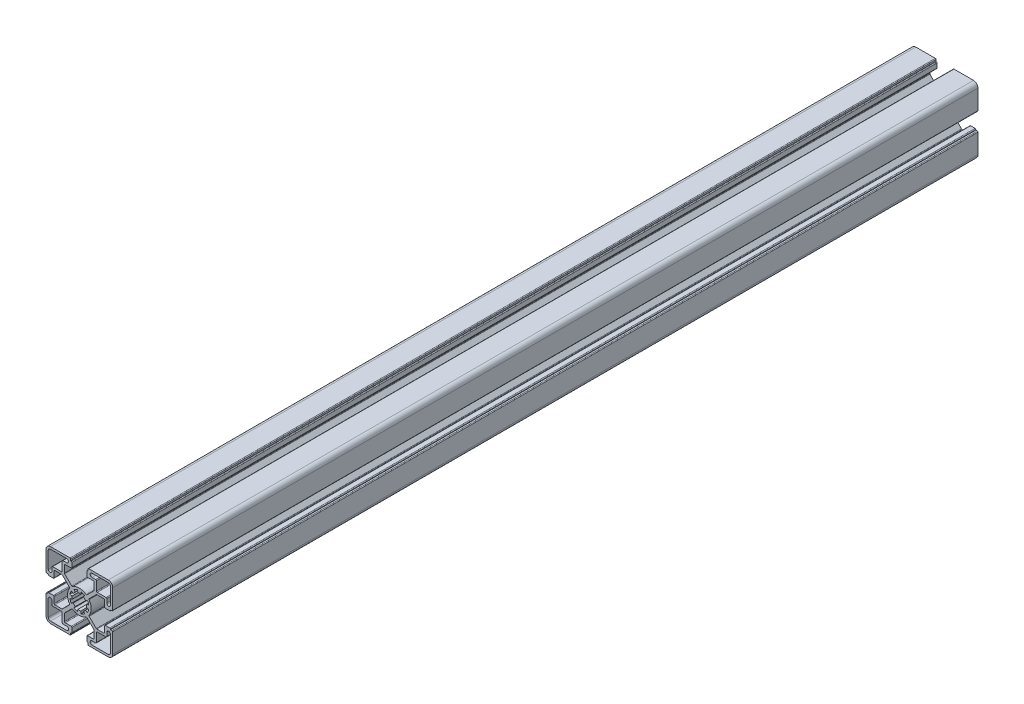
from build123d import *

# Parameters (mm, degrees)
BOSS_EXTRUDE1_DEPTH      = 152.4
BOSS_EXTRUDE1_DEPTH_BACK = 152.4
SKETCH3_R                = 5
FILLET1_R                = 0.5
CUT_EXTRUDE1_DEPTH       = 307.456424309
BOSS_EXTRUDE2_DEPTH      = 279.1


with BuildPart() as part:
    # Sketch3 → Boss-Extrude1 (new, two sides: drawn at the far end of the back side and taken through both)
    with BuildSketch(Plane.XY.offset(-BOSS_EXTRUDE1_DEPTH_BACK)):
        with BuildLine():
            Line((-11.55, -10.05), (-6.356915373, -4.856915373))
            ThreePointArc((-6.356915373, -4.856915373), (-8, 0), (-6.356915373, 4.856915373))
            Line((-6.356915373, 4.856915373), (-11.55, 10.05))
            Line((-11.55, 10.05), (-17.025, 10.05))
            Line((-17.025, 10.05), (-17.025, 5))
            Line((-17.025, 5), (-21, 5))
            Line((-21, 5), (-21, 5.8))
            Line((-21, 5.8), (-22.5, 5.8))
            Line((-22.5, 5.8), (-22.5, 19.5))
            ThreePointArc((-22.5, 19.5), (-21.621320344, 21.621320344), (-19.5, 22.5))
            Line((-19.5, 22.5), (-5.8, 22.5))
            Line((-5.8, 22.5), (-5.8, 21))
            Line((-5.8, 21), (-5, 21))
            Line((-5, 21), (-5, 17.025))
            Line((-5, 17.025), (-10.05, 17.025))
            Line((-10.05, 17.025), (-10.05, 11.55))
            Line((-10.05, 11.55), (-4.856915373, 6.356915373))
            ThreePointArc((-4.856915373, 6.356915373), (0, 8), (4.856915373, 6.356915373))
            Line((4.856915373, 6.356915373), (10.05, 11.55))
            Line((10.05, 11.55), (10.05, 17.025))
            Line((10.05, 17.025), (5, 17.025))
            Line((5, 17.025), (5, 21))
            Line((5, 21), (5.8, 21))
            Line((5.8, 21), (5.8, 22.5))
            Line((5.8, 22.5), (19.5, 22.5))
            ThreePointArc((19.5, 22.5), (21.621320344, 21.621320344), (22.5, 19.5))
            Line((22.5, 19.5), (22.5, 5.8))
            Line((22.5, 5.8), (21, 5.8))
            Line((21, 5.8), (21, 5))
            Line((21, 5), (17.025, 5))
            Line((17.025, 5), (17.025, 10.05))
            Line((17.025, 10.05), (11.55, 10.05))
            Line((11.55, 10.05), (6.356915373, 4.856915373))
            ThreePointArc((6.356915373, 4.856915373), (8, 0), (6.356915373, -4.856915373))
            Line((6.356915373, -4.856915373), (11.55, -10.05))
            Line((11.55, -10.05), (17.025, -10.05))
            Line((17.025, -10.05), (17.025, -5))
            Line((17.025, -5), (21, -5))
            Line((21, -5), (21, -5.8))
            Line((21, -5.8), (22.5, -5.8))
            Line((22.5, -5.8), (22.5, -19.5))
            ThreePointArc((22.5, -19.5), (21.621320344, -21.621320344), (19.5, -22.5))
            Line((19.5, -22.5), (5.8, -22.5))
            Line((5.8, -22.5), (5.8, -21))
            Line((5.8, -21), (5, -21))
            Line((5, -21), (5, -17.025))
            Line((5, -17.025), (10.05, -17.025))
            Line((10.05, -17.025), (10.05, -11.55))
            Line((10.05, -11.55), (4.856915373, -6.356915373))
            ThreePointArc((4.856915373, -6.356915373), (0, -8), (-4.856915373, -6.356915373))
            Line((-4.856915373, -6.356915373), (-10.05, -11.55))
            Line((-10.05, -11.55), (-10.05, -17.025))
            Line((-10.05, -17.025), (-5, -17.025))
            Line((-5, -17.025), (-5, -21))
            Line((-5, -21), (-5.8, -21))
            Line((-5.8, -21), (-5.8, -22.5))
            Line((-5.8, -22.5), (-19.5, -22.5))
            ThreePointArc((-19.5, -22.5), (-21.621320344, -21.621320344), (-22.5, -19.5))
            Line((-22.5, -19.5), (-22.5, -5.8))
            Line((-22.5, -5.8), (-21, -5.8))
            Line((-21, -5.8), (-21, -5))
            Line((-21, -5), (-17.025, -5))
            Line((-17.025, -5), (-17.025, -10.05))
            Line((-17.025, -10.05), (-11.55, -10.05))
        make_face()
        with Locations(Location((0, 0, 0), (0, 0, 180))):
            Circle(SKETCH3_R, mode=Mode.SUBTRACT)
        with BuildLine():
            Line((-21, 8.5375), (-21, 19.5))
            ThreePointArc((-21, 19.5), (-20.560660172, 20.560660172), (-19.5, 21))
            Line((-19.5, 21), (-8.5375, 21))
            ThreePointArc((-8.5375, 21), (-7.3, 19.7625), (-8.5375, 18.525))
            Line((-8.5375, 18.525), (-11.55, 18.525))
            Line((-11.55, 18.525), (-11.55, 11.55))
            Line((-11.55, 11.55), (-18.525, 11.55))
            Line((-18.525, 11.55), (-18.525, 8.5375))
            ThreePointArc((-18.525, 8.5375), (-19.7625, 7.3), (-21, 8.5375))
        make_face(mode=Mode.SUBTRACT)
        with BuildLine():
            Line((8.5375, 21), (19.5, 21))
            ThreePointArc((19.5, 21), (20.560660172, 20.560660172), (21, 19.5))
            Line((21, 19.5), (21, 8.5375))
            ThreePointArc((21, 8.5375), (19.7625, 7.3), (18.525, 8.5375))
            Line((18.525, 8.5375), (18.525, 11.55))
            Line((18.525, 11.55), (11.55, 11.55))
            Line((11.55, 11.55), (11.55, 18.525))
            Line((11.55, 18.525), (8.5375, 18.525))
            ThreePointArc((8.5375, 18.525), (7.3, 19.7625), (8.5375, 21))
        make_face(mode=Mode.SUBTRACT)
        with BuildLine():
            Line((21, -8.5375), (21, -19.5))
            ThreePointArc((21, -19.5), (20.560660172, -20.560660172), (19.5, -21))
            Line((19.5, -21), (8.5375, -21))
            ThreePointArc((8.5375, -21), (7.3, -19.7625), (8.5375, -18.525))
            Line((8.5375, -18.525), (11.55, -18.525))
            Line((11.55, -18.525), (11.55, -11.55))
            Line((11.55, -11.55), (18.525, -11.55))
            Line((18.525, -11.55), (18.525, -8.5375))
            ThreePointArc((18.525, -8.5375), (19.7625, -7.3), (21, -8.5375))
        make_face(mode=Mode.SUBTRACT)
        with BuildLine():
            Line((-8.5375, -21), (-19.5, -21))
            ThreePointArc((-19.5, -21), (-20.560660172, -20.560660172), (-21, -19.5))
            Line((-21, -19.5), (-21, -8.5375))
            ThreePointArc((-21, -8.5375), (-19.7625, -7.3), (-18.525, -8.5375))
            Line((-18.525, -8.5375), (-18.525, -11.55))
            Line((-18.525, -11.55), (-11.55, -11.55))
            Line((-11.55, -11.55), (-11.55, -18.525))
            Line((-11.55, -18.525), (-8.5375, -18.525))
            ThreePointArc((-8.5375, -18.525), (-7.3, -19.7625), (-8.5375, -21))
        make_face(mode=Mode.SUBTRACT)
    extrude(amount=BOSS_EXTRUDE1_DEPTH + BOSS_EXTRUDE1_DEPTH_BACK)

    # Fillet1
    fillet1_edges = [part.edges().sort_by_distance(p)[0] for p in [
        (-11.55, -18.525, 0),
        (-11.55, -11.55, 0),
        (18.525, -11.55, 0),
        (11.55, -11.55, 0),
        (11.55, -18.525, 0),
        (11.55, 18.525, 0),
        (11.55, 11.55, 0),
        (18.525, 11.55, 0),
        (-18.525, 11.55, 0),
        (-11.55, 11.55, 0),
        (-11.55, 18.525, 0),
        (6.356915373, -4.856915373, 0),
        (11.55, -10.05, 0),
        (17.025, -10.05, 0),
        (17.025, -5, 0),
        (21, -5, 0),
        (22.5, -5.8, 0),
        (5.8, -22.5, 0),
        (5, -21, 0),
        (5, -17.025, 0),
        (10.05, -17.025, 0),
        (10.05, -11.55, 0),
        (4.856915373, -6.356915373, 0),
        (-4.856915373, -6.356915373, 0),
        (-10.05, -11.55, 0),
        (-10.05, -17.025, 0),
        (-5, -17.025, 0),
        (-5, -21, 0),
        (-5.8, -22.5, 0),
        (-22.5, -5.8, 0),
        (-21, -5, 0),
        (-17.025, -5, 0),
        (-17.025, -10.05, 0),
        (-11.55, -10.05, 0),
        (-6.356915373, -4.856915373, 0),
        (-6.356915373, 4.856915373, 0),
        (-11.55, 10.05, 0),
        (-17.025, 10.05, 0),
        (-17.025, 5, 0),
        (-21, 5, 0),
        (-22.5, 5.8, 0),
        (-5.8, 22.5, 0),
        (-5, 21, 0),
        (-5, 17.025, 0),
        (-10.05, 17.025, 0),
        (-10.05, 11.55, 0),
        (-4.856915373, 6.356915373, 0),
        (4.856915373, 6.356915373, 0),
        (10.05, 11.55, 0),
        (10.05, 17.025, 0),
        (5, 17.025, 0),
        (5, 21, 0),
        (5.8, 22.5, 0),
        (22.5, 5.8, 0),
        (21, 5, 0),
        (17.025, 5, 0),
        (11.55, 10.05, 0),
        (6.356915373, 4.856915373, 0),
    ]]
    fillet(fillet1_edges, radius=FILLET1_R)

    # Sketch4 → Cut-Extrude1 (cut, through all)
    with BuildSketch(Plane.XY.offset(152.4)):
        with BuildLine():
            Line((-1.268087093, 6.375104323), (-0.97545161, 4.903926402))
            ThreePointArc((-0.97545161, 4.903926402), (-1.913417162, 4.619397663), (-2.777851165, 4.157348062))
            Line((-2.777851165, 4.157348062), (-3.611206515, 5.40455248))
            ThreePointArc((-3.611206515, 5.40455248), (-2.48744231, 6.005216961), (-1.268087093, 6.375104323))
        make_face()
        with BuildLine():
            Line((1.268087093, 6.375104323), (0.97545161, 4.903926402))
            ThreePointArc((0.97545161, 4.903926402), (1.913417162, 4.619397663), (2.777851165, 4.157348062))
            Line((2.777851165, 4.157348062), (3.611206515, 5.40455248))
            ThreePointArc((3.611206515, 5.40455248), (2.48744231, 6.005216961), (1.268087093, 6.375104323))
        make_face()
        with BuildLine():
            Line((5.40455248, 3.611206515), (4.157348062, 2.777851165))
            ThreePointArc((4.157348062, 2.777851165), (4.619397663, 1.913417162), (4.903926402, 0.97545161))
            Line((4.903926402, 0.97545161), (6.375104323, 1.268087093))
            ThreePointArc((6.375104323, 1.268087093), (6.005216961, 2.48744231), (5.40455248, 3.611206515))
        make_face()
        with BuildLine():
            Line((6.375104323, -1.268087093), (4.903926402, -0.97545161))
            ThreePointArc((4.903926402, -0.97545161), (4.619397663, -1.913417162), (4.157348062, -2.777851165))
            Line((4.157348062, -2.777851165), (5.40455248, -3.611206515))
            ThreePointArc((5.40455248, -3.611206515), (6.005216961, -2.48744231), (6.375104323, -1.268087093))
        make_face()
        with BuildLine():
            Line((3.611206515, -5.40455248), (2.777851165, -4.157348062))
            ThreePointArc((2.777851165, -4.157348062), (1.913417162, -4.619397663), (0.97545161, -4.903926402))
            Line((0.97545161, -4.903926402), (1.268087093, -6.375104323))
            ThreePointArc((1.268087093, -6.375104323), (2.48744231, -6.005216961), (3.611206515, -5.40455248))
        make_face()
        with BuildLine():
            Line((-1.268087093, -6.375104323), (-0.97545161, -4.903926402))
            ThreePointArc((-0.97545161, -4.903926402), (-1.913417162, -4.619397663), (-2.777851165, -4.157348062))
            Line((-2.777851165, -4.157348062), (-3.611206515, -5.40455248))
            ThreePointArc((-3.611206515, -5.40455248), (-2.48744231, -6.005216961), (-1.268087093, -6.375104323))
        make_face()
        with BuildLine():
            Line((-5.40455248, -3.611206515), (-4.157348062, -2.777851165))
            ThreePointArc((-4.157348062, -2.777851165), (-4.619397663, -1.913417162), (-4.903926402, -0.97545161))
            Line((-4.903926402, -0.97545161), (-6.375104323, -1.268087093))
            ThreePointArc((-6.375104323, -1.268087093), (-6.005216961, -2.48744231), (-5.40455248, -3.611206515))
        make_face()
        with BuildLine():
            Line((-6.375104323, 1.268087093), (-4.903926402, 0.97545161))
            ThreePointArc((-4.903926402, 0.97545161), (-4.619397663, 1.913417162), (-4.157348062, 2.777851165))
            Line((-4.157348062, 2.777851165), (-5.40455248, 3.611206515))
            ThreePointArc((-5.40455248, 3.611206515), (-6.005216961, 2.48744231), (-6.375104323, 1.268087093))
        make_face()
    extrude(amount=-CUT_EXTRUDE1_DEPTH, mode=Mode.SUBTRACT)

    # Sketch5 → Boss-Extrude2 (add)
    with BuildSketch(Plane.XY.offset(152.4)):
        with BuildLine():
            Line((22.5, -19.5), (22.5, -6.3))
            ThreePointArc((22.5, -6.3), (22.353553391, -5.946446609), (22, -5.8))
            Line((22, -5.8), (21, -5.8))
            Line((21, -5.8), (21, -5.5))
            ThreePointArc((21, -5.5), (20.853553391, -5.146446609), (20.5, -5))
            Line((20.5, -5), (17.525, -5))
            ThreePointArc((17.525, -5), (17.171446609, -5.146446609), (17.025, -5.5))
            Line((17.025, -5.5), (17.025, -9.55))
            ThreePointArc((17.025, -9.55), (16.878553391, -9.903553391), (16.525, -10.05))
            Line((16.525, -10.05), (11.757106781, -10.05))
            ThreePointArc((11.757106781, -10.05), (11.565765065, -10.011939766), (11.403553391, -9.903553391))
            Line((11.403553391, -9.903553391), (6.658229, -5.158229))
            ThreePointArc((6.658229, -5.158229), (6.513911961, -4.850773717), (6.599324603, -4.522047632))
            ThreePointArc((6.599324603, -4.522047632), (8, 0), (6.599324603, 4.522047632))
            ThreePointArc((6.599324603, 4.522047632), (6.513911961, 4.850773717), (6.658229, 5.158229))
            Line((6.658229, 5.158229), (11.403553391, 9.903553391))
            ThreePointArc((11.403553391, 9.903553391), (11.565765065, 10.011939766), (11.757106781, 10.05))
            Line((11.757106781, 10.05), (17.025, 10.05))
            Line((17.025, 10.05), (17.025, 5.5))
            ThreePointArc((17.025, 5.5), (17.171446609, 5.146446609), (17.525, 5))
            Line((17.525, 5), (20.5, 5))
            ThreePointArc((20.5, 5), (20.853553391, 5.146446609), (21, 5.5))
            Line((21, 5.5), (21, 5.8))
            Line((21, 5.8), (22, 5.8))
            ThreePointArc((22, 5.8), (22.353553391, 5.946446609), (22.5, 6.3))
            Line((22.5, 6.3), (22.5, 19.5))
            ThreePointArc((22.5, 19.5), (21.621320344, 21.621320344), (19.5, 22.5))
            Line((19.5, 22.5), (6.3, 22.5))
            ThreePointArc((6.3, 22.5), (5.946446609, 22.353553391), (5.8, 22))
            Line((5.8, 22), (5.8, 21))
            Line((5.8, 21), (5.5, 21))
            ThreePointArc((5.5, 21), (5.146446609, 20.853553391), (5, 20.5))
            Line((5, 20.5), (5, 17.525))
            ThreePointArc((5, 17.525), (5.146446609, 17.171446609), (5.5, 17.025))
            Line((5.5, 17.025), (9.55, 17.025))
            ThreePointArc((9.55, 17.025), (9.903553391, 16.878553391), (10.05, 16.525))
            Line((10.05, 16.525), (10.05, 11.757106781))
            ThreePointArc((10.05, 11.757106781), (10.011939766, 11.565765065), (9.903553391, 11.403553391))
            Line((9.903553391, 11.403553391), (5.158229, 6.658229))
            ThreePointArc((5.158229, 6.658229), (4.850773717, 6.513911961), (4.522047632, 6.599324603))
            ThreePointArc((4.522047632, 6.599324603), (0, 8), (-4.522047632, 6.599324603))
            ThreePointArc((-4.522047632, 6.599324603), (-4.850773717, 6.513911961), (-5.158229, 6.658229))
            Line((-5.158229, 6.658229), (-9.903553391, 11.403553391))
            ThreePointArc((-9.903553391, 11.403553391), (-10.011939766, 11.565765065), (-10.05, 11.757106781))
            Line((-10.05, 11.757106781), (-10.05, 16.525))
            ThreePointArc((-10.05, 16.525), (-9.903553391, 16.878553391), (-9.55, 17.025))
            Line((-9.55, 17.025), (-5.5, 17.025))
            ThreePointArc((-5.5, 17.025), (-5.146446609, 17.171446609), (-5, 17.525))
            Line((-5, 17.525), (-5, 20.5))
            ThreePointArc((-5, 20.5), (-5.146446609, 20.853553391), (-5.5, 21))
            Line((-5.5, 21), (-5.8, 21))
            Line((-5.8, 21), (-5.8, 22))
            ThreePointArc((-5.8, 22), (-5.946446609, 22.353553391), (-6.3, 22.5))
            Line((-6.3, 22.5), (-19.5, 22.5))
            ThreePointArc((-19.5, 22.5), (-21.621320344, 21.621320344), (-22.5, 19.5))
            Line((-22.5, 19.5), (-22.5, 6.3))
            ThreePointArc((-22.5, 6.3), (-22.353553391, 5.946446609), (-22, 5.8))
            Line((-22, 5.8), (-21, 5.8))
            Line((-21, 5.8), (-21, 5.5))
            ThreePointArc((-21, 5.5), (-20.853553391, 5.146446609), (-20.5, 5))
            Line((-20.5, 5), (-17.525, 5))
            ThreePointArc((-17.525, 5), (-17.171446609, 5.146446609), (-17.025, 5.5))
            Line((-17.025, 5.5), (-17.025, 9.55))
            ThreePointArc((-17.025, 9.55), (-16.878553391, 9.903553391), (-16.525, 10.05))
            Line((-16.525, 10.05), (-11.757106781, 10.05))
            ThreePointArc((-11.757106781, 10.05), (-11.565765065, 10.011939766), (-11.403553391, 9.903553391))
            Line((-11.403553391, 9.903553391), (-6.658229, 5.158229))
            ThreePointArc((-6.658229, 5.158229), (-6.513911961, 4.850773717), (-6.599324603, 4.522047632))
            ThreePointArc((-6.599324603, 4.522047632), (-8, 0), (-6.599324603, -4.522047632))
            ThreePointArc((-6.599324603, -4.522047632), (-6.513911961, -4.850773717), (-6.658229, -5.158229))
            Line((-6.658229, -5.158229), (-11.403553391, -9.903553391))
            ThreePointArc((-11.403553391, -9.903553391), (-11.565765065, -10.011939766), (-11.757106781, -10.05))
            Line((-11.757106781, -10.05), (-16.525, -10.05))
            ThreePointArc((-16.525, -10.05), (-16.878553391, -9.903553391), (-17.025, -9.55))
            Line((-17.025, -9.55), (-17.025, -5.5))
            ThreePointArc((-17.025, -5.5), (-17.171446609, -5.146446609), (-17.525, -5))
            Line((-17.525, -5), (-20.5, -5))
            ThreePointArc((-20.5, -5), (-20.853553391, -5.146446609), (-21, -5.5))
            Line((-21, -5.5), (-21, -5.8))
            Line((-21, -5.8), (-22, -5.8))
            ThreePointArc((-22, -5.8), (-22.353553391, -5.946446609), (-22.5, -6.3))
            Line((-22.5, -6.3), (-22.5, -19.5))
            ThreePointArc((-22.5, -19.5), (-21.621320344, -21.621320344), (-19.5, -22.5))
            Line((-19.5, -22.5), (-6.3, -22.5))
            ThreePointArc((-6.3, -22.5), (-5.946446609, -22.353553391), (-5.8, -22))
            Line((-5.8, -22), (-5.8, -21))
            Line((-5.8, -21), (-5.5, -21))
            ThreePointArc((-5.5, -21), (-5.146446609, -20.853553391), (-5, -20.5))
            Line((-5, -20.5), (-5, -17.525))
            ThreePointArc((-5, -17.525), (-5.146446609, -17.171446609), (-5.5, -17.025))
            Line((-5.5, -17.025), (-9.55, -17.025))
            ThreePointArc((-9.55, -17.025), (-9.903553391, -16.878553391), (-10.05, -16.525))
            Line((-10.05, -16.525), (-10.05, -11.757106781))
            ThreePointArc((-10.05, -11.757106781), (-10.011939766, -11.565765065), (-9.903553391, -11.403553391))
            Line((-9.903553391, -11.403553391), (-5.158229, -6.658229))
            ThreePointArc((-5.158229, -6.658229), (-4.850773717, -6.513911961), (-4.522047632, -6.599324603))
            ThreePointArc((-4.522047632, -6.599324603), (0, -8), (4.522047632, -6.599324603))
            ThreePointArc((4.522047632, -6.599324603), (4.850773717, -6.513911961), (5.158229, -6.658229))
            Line((5.158229, -6.658229), (9.903553391, -11.403553391))
            ThreePointArc((9.903553391, -11.403553391), (10.011939766, -11.565765065), (10.05, -11.757106781))
            Line((10.05, -11.757106781), (10.05, -16.525))
            ThreePointArc((10.05, -16.525), (9.903553391, -16.878553391), (9.55, -17.025))
            Line((9.55, -17.025), (5.5, -17.025))
            ThreePointArc((5.5, -17.025), (5.146446609, -17.171446609), (5, -17.525))
            Line((5, -17.525), (5, -20.5))
            ThreePointArc((5, -20.5), (5.146446609, -20.853553391), (5.5, -21))
            Line((5.5, -21), (5.8, -21))
            Line((5.8, -21), (5.8, -22))
            ThreePointArc((5.8, -22), (5.946446609, -22.353553391), (6.3, -22.5))
            Line((6.3, -22.5), (19.5, -22.5))
            ThreePointArc((19.5, -22.5), (21.621320344, -21.621320344), (22.5, -19.5))
        make_face()
        with BuildLine():
            Line((-11.55, -18.025), (-11.55, -12.05))
            ThreePointArc((-11.55, -12.05), (-11.696446609, -11.696446609), (-12.05, -11.55))
            Line((-12.05, -11.55), (-18.525, -11.55))
            Line((-18.525, -11.55), (-18.525, -8.5375))
            ThreePointArc((-18.525, -8.5375), (-19.7625, -7.3), (-21, -8.5375))
            Line((-21, -8.5375), (-21, -19.5))
            ThreePointArc((-21, -19.5), (-20.560660172, -20.560660172), (-19.5, -21))
            Line((-19.5, -21), (-8.5375, -21))
            ThreePointArc((-8.5375, -21), (-7.3, -19.7625), (-8.5375, -18.525))
            Line((-8.5375, -18.525), (-11.05, -18.525))
            ThreePointArc((-11.05, -18.525), (-11.403553391, -18.378553391), (-11.55, -18.025))
        make_face(mode=Mode.SUBTRACT)
        with BuildLine():
            Line((-0.97545161, 4.903926402), (-1.268087093, 6.375104323))
            ThreePointArc((-1.268087093, 6.375104323), (-2.48744231, 6.005216961), (-3.611206515, 5.40455248))
            Line((-3.611206515, 5.40455248), (-2.777851165, 4.157348062))
            ThreePointArc((-2.777851165, 4.157348062), (-3.535533906, 3.535533906), (-4.157348062, 2.777851165))
            Line((-4.157348062, 2.777851165), (-5.40455248, 3.611206515))
            ThreePointArc((-5.40455248, 3.611206515), (-6.005216961, 2.48744231), (-6.375104323, 1.268087093))
            Line((-6.375104323, 1.268087093), (-4.903926402, 0.97545161))
            ThreePointArc((-4.903926402, 0.97545161), (-5, 0), (-4.903926402, -0.97545161))
            Line((-4.903926402, -0.97545161), (-6.375104323, -1.268087093))
            ThreePointArc((-6.375104323, -1.268087093), (-6.005216961, -2.48744231), (-5.40455248, -3.611206515))
            Line((-5.40455248, -3.611206515), (-4.157348062, -2.777851165))
            ThreePointArc((-4.157348062, -2.777851165), (-3.535533906, -3.535533906), (-2.777851165, -4.157348062))
            Line((-2.777851165, -4.157348062), (-3.611206515, -5.40455248))
            ThreePointArc((-3.611206515, -5.40455248), (-2.48744231, -6.005216961), (-1.268087093, -6.375104323))
            Line((-1.268087093, -6.375104323), (-0.97545161, -4.903926402))
            ThreePointArc((-0.97545161, -4.903926402), (0, -5), (0.97545161, -4.903926402))
            Line((0.97545161, -4.903926402), (1.268087093, -6.375104323))
            ThreePointArc((1.268087093, -6.375104323), (2.48744231, -6.005216961), (3.611206515, -5.40455248))
            Line((3.611206515, -5.40455248), (2.777851165, -4.157348062))
            ThreePointArc((2.777851165, -4.157348062), (3.535533906, -3.535533906), (4.157348062, -2.777851165))
            Line((4.157348062, -2.777851165), (5.40455248, -3.611206515))
            ThreePointArc((5.40455248, -3.611206515), (6.005216961, -2.48744231), (6.375104323, -1.268087093))
            Line((6.375104323, -1.268087093), (4.903926402, -0.97545161))
            ThreePointArc((4.903926402, -0.97545161), (5, 0), (4.903926402, 0.97545161))
            Line((4.903926402, 0.97545161), (6.375104323, 1.268087093))
            ThreePointArc((6.375104323, 1.268087093), (6.005216961, 2.48744231), (5.40455248, 3.611206515))
            Line((5.40455248, 3.611206515), (4.157348062, 2.777851165))
            ThreePointArc((4.157348062, 2.777851165), (3.535533906, 3.535533906), (2.777851165, 4.157348062))
            Line((2.777851165, 4.157348062), (3.611206515, 5.40455248))
            ThreePointArc((3.611206515, 5.40455248), (2.48744231, 6.005216961), (1.268087093, 6.375104323))
            Line((1.268087093, 6.375104323), (0.97545161, 4.903926402))
            ThreePointArc((0.97545161, 4.903926402), (0, 5), (-0.97545161, 4.903926402))
        make_face(mode=Mode.SUBTRACT)
        with BuildLine():
            Line((18.025, -11.55), (12.05, -11.55))
            ThreePointArc((12.05, -11.55), (11.696446609, -11.696446609), (11.55, -12.05))
            Line((11.55, -12.05), (11.55, -18.025))
            ThreePointArc((11.55, -18.025), (11.403553391, -18.378553391), (11.05, -18.525))
            Line((11.05, -18.525), (8.5375, -18.525))
            ThreePointArc((8.5375, -18.525), (7.3, -19.7625), (8.5375, -21))
            Line((8.5375, -21), (19.5, -21))
            ThreePointArc((19.5, -21), (20.560660172, -20.560660172), (21, -19.5))
            Line((21, -19.5), (21, -8.5375))
            ThreePointArc((21, -8.5375), (19.7625, -7.3), (18.525, -8.5375))
            Line((18.525, -8.5375), (18.525, -11.05))
            ThreePointArc((18.525, -11.05), (18.378553391, -11.403553391), (18.025, -11.55))
        make_face(mode=Mode.SUBTRACT)
        with BuildLine():
            Line((11.55, 18.025), (11.55, 12.05))
            ThreePointArc((11.55, 12.05), (11.696446609, 11.696446609), (12.05, 11.55))
            Line((12.05, 11.55), (18.025, 11.55))
            ThreePointArc((18.025, 11.55), (18.378553391, 11.403553391), (18.525, 11.05))
            Line((18.525, 11.05), (18.525, 8.5375))
            ThreePointArc((18.525, 8.5375), (19.7625, 7.3), (21, 8.5375))
            Line((21, 8.5375), (21, 19.5))
            ThreePointArc((21, 19.5), (20.560660172, 20.560660172), (19.5, 21))
            Line((19.5, 21), (8.5375, 21))
            ThreePointArc((8.5375, 21), (7.3, 19.7625), (8.5375, 18.525))
            Line((8.5375, 18.525), (11.05, 18.525))
            ThreePointArc((11.05, 18.525), (11.403553391, 18.378553391), (11.55, 18.025))
        make_face(mode=Mode.SUBTRACT)
        with BuildLine():
            Line((-18.025, 11.55), (-12.05, 11.55))
            ThreePointArc((-12.05, 11.55), (-11.696446609, 11.696446609), (-11.55, 12.05))
            Line((-11.55, 12.05), (-11.55, 18.025))
            ThreePointArc((-11.55, 18.025), (-11.403553391, 18.378553391), (-11.05, 18.525))
            Line((-11.05, 18.525), (-8.5375, 18.525))
            ThreePointArc((-8.5375, 18.525), (-7.3, 19.7625), (-8.5375, 21))
            Line((-8.5375, 21), (-19.5, 21))
            ThreePointArc((-19.5, 21), (-20.560660172, 20.560660172), (-21, 19.5))
            Line((-21, 19.5), (-21, 8.5375))
            ThreePointArc((-21, 8.5375), (-19.7625, 7.3), (-18.525, 8.5375))
            Line((-18.525, 8.5375), (-18.525, 11.05))
            ThreePointArc((-18.525, 11.05), (-18.378553391, 11.403553391), (-18.025, 11.55))
        make_face(mode=Mode.SUBTRACT)
    extrude(amount=BOSS_EXTRUDE2_DEPTH)


solid = part.part
